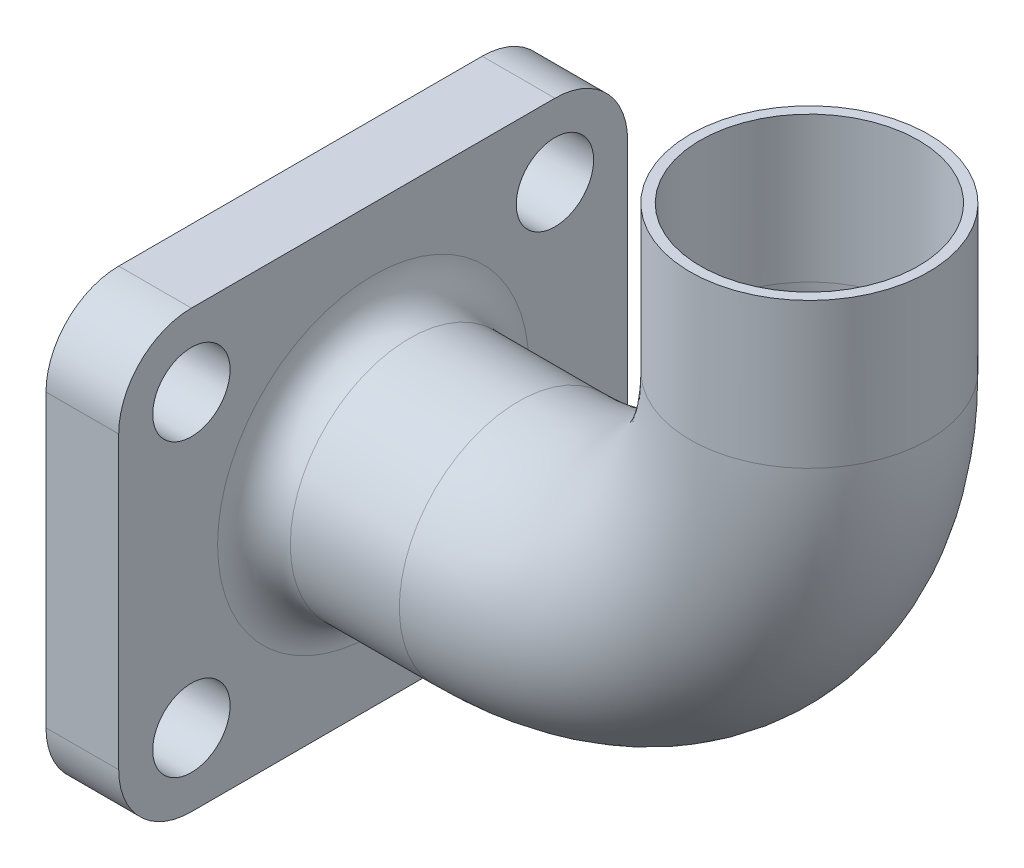
from build123d import *

# Parameters (mm, degrees)
SKETCH1_R               = 9.525
BOSS_EXTRUDE1_DEPTH     = 6.35
SKETCH3_R               = 10.414
SKETCH3_R_2             = 9.525
BOSS_EXTRUDE2_START     = 2.921
SKETCH4_R               = 12.7
SKETCH4_R_2             = 9.525
BOSS_EXTRUDE2_DEPTH     = 2.921
FILLET1_R               = 3.175
F_1_4_CLEARANCE_HOLE1_D = 6.7564


with BuildPart() as part:
    # Sketch1 → Boss-Extrude1 (new body)
    with BuildSketch(Plane(origin=(0, 0, 0), x_dir=(0, 0, -1), z_dir=(1, 0, 0))):
        with BuildLine():
            Line((-15.875, -19.05), (15.875, -19.05))
            ThreePointArc((15.875, -19.05), (20.365128061, -17.190128061), (22.225, -12.7))
            Line((22.225, -12.7), (22.225, 12.7))
            ThreePointArc((22.225, 12.7), (20.365128061, 17.190128061), (15.875, 19.05))
            Line((15.875, 19.05), (-15.875, 19.05))
            ThreePointArc((-15.875, 19.05), (-20.365128061, 17.190128061), (-22.225, 12.7))
            Line((-22.225, 12.7), (-22.225, -12.7))
            ThreePointArc((-22.225, -12.7), (-20.365128061, -17.190128061), (-15.875, -19.05))
        make_face()
        Circle(SKETCH1_R, mode=Mode.SUBTRACT)
    extrude(amount=BOSS_EXTRUDE1_DEPTH)

    # Sweep-Thin1: sweep along a path in Sketch2
    with BuildLine(Plane.XY) as sweep_thin1_path:
        Line((6.35, 0), (19.05, 0))
        ThreePointArc((19.05, 0), (37.010512242, 7.439487758), (44.45, 25.4))
        Line((44.45, 25.4), (44.45, 38.1))
    # Sketch3 → Sweep-Thin1 (sweep)
    with BuildSketch(Plane(origin=(6.35, 0, 0), x_dir=(0, 0, -1), z_dir=(1, 0, 0))):
        Circle(SKETCH3_R)
        Circle(SKETCH3_R_2, mode=Mode.SUBTRACT)
    sweep(path=sweep_thin1_path.line)

    # Sketch4 → Boss-Extrude2 (add)
    with BuildSketch(Plane.ZY.offset(BOSS_EXTRUDE2_START)):
        Circle(SKETCH4_R)
        Circle(SKETCH4_R_2, mode=Mode.SUBTRACT)
    extrude(amount=-BOSS_EXTRUDE2_DEPTH)

    # Fillet1
    fillet1_edges = [part.edges().sort_by_distance(p)[0] for p in [
        (6.35, 0, 10.414),
    ]]
    fillet(fillet1_edges, radius=FILLET1_R)

    # 1/4 Clearance Hole1 (through all)
    with Locations(Plane(origin=(6.35, 0, 0), x_dir=(0, 0, -1), z_dir=(1, 0, 0))):
        with Locations((-15.875, 12.7), (15.875, 12.7), (15.875, -12.7), (-15.875, -12.7)):
            Hole(F_1_4_CLEARANCE_HOLE1_D / 2)


solid = part.part
